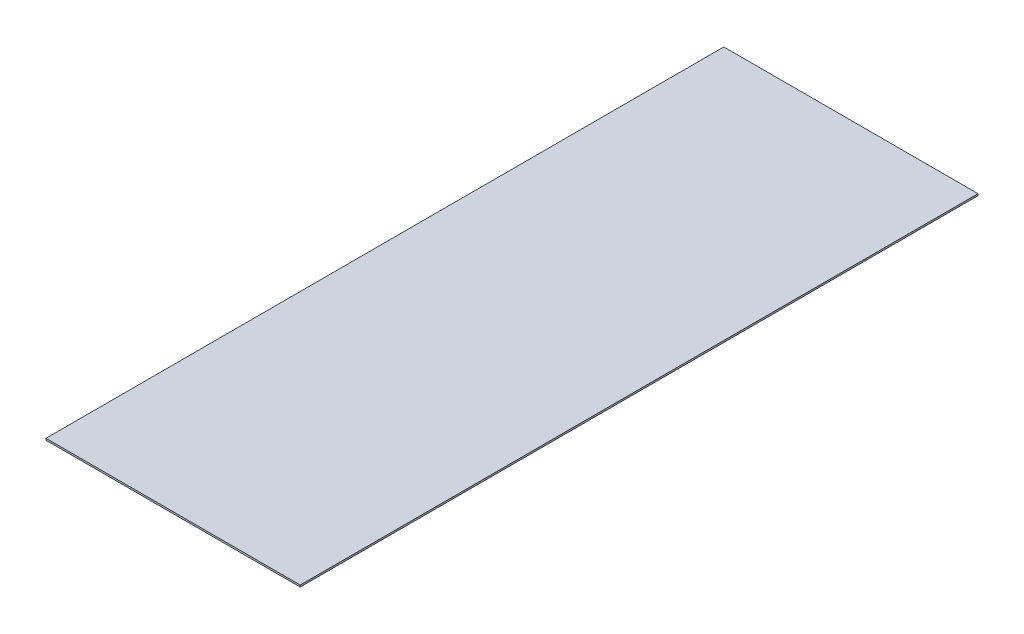
from build123d import *

# Parameters (mm, degrees)
CROQUIS1_W              = 914.4
CROQUIS1_H              = 2438.4
SALIENTE_EXTRUIR1_DEPTH = 6.4


with BuildPart() as part:
    # Croquis1 → Saliente-Extruir1 (new body)
    with BuildSketch(Plane(origin=(0, 0, 0), x_dir=(1, 0, 0), z_dir=(0, 1, 0))):
        Rectangle(CROQUIS1_W, CROQUIS1_H)
    extrude(amount=SALIENTE_EXTRUIR1_DEPTH)


solid = part.part
